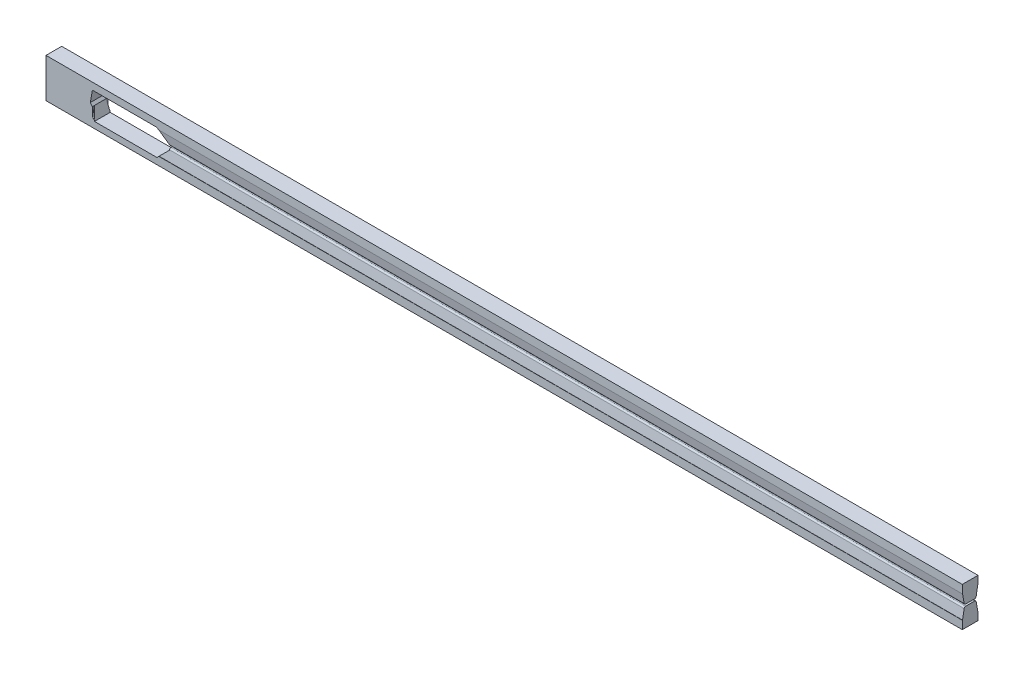
from build123d import *

# Parameters (mm, degrees)
EXTRUDE_THIN3_DEPTH      = 664
EXTRUDE_THIN3_DEPTH_BACK = 818
SKETCH1_W                = 25.4
SKETCH1_H                = 30.226
CUT_EXTRUDE1_DEPTH       = 674
CUT_EXTRUDE1_DEPTH_BACK  = 743
SKETCH4_W                = 80
SKETCH4_H                = 25.4
BOSS_EXTRUDE1_DEPTH      = 3.048
CUT_EXTRUDE2_DEPTH       = 178


with BuildPart() as part:
    # Sketch1 → Extrude-Thin3 (new, two sides: drawn at the far end of the back side and taken through both)
    with BuildSketch(Plane(origin=(0, 0, 0), x_dir=(0, 0, -1), z_dir=(1, 0, 0)).offset(-EXTRUDE_THIN3_DEPTH_BACK)):
        with Locations((-93.98, -189.611)):
            Rectangle(SKETCH1_W, SKETCH1_H)
    extrude(amount=EXTRUDE_THIN3_DEPTH + EXTRUDE_THIN3_DEPTH_BACK)

    # Sketch3 → Cut-Extrude1 (cut, two sides: drawn at the far end of the back side and taken through both)
    with BuildSketch(Plane(origin=(0, 0, 0), x_dir=(0, 0, -1), z_dir=(1, 0, 0)).offset(-CUT_EXTRUDE1_DEPTH_BACK)):
        with BuildLine():
            Line((-81.650098629, -187.772933629), (-84.268930353, -202.625066371))
            ThreePointArc((-84.268930353, -202.625066371), (-85.137661517, -204.129752886), (-86.770342046, -204.724))
            Line((-86.770342046, -204.724), (-101.189657954, -204.724))
            ThreePointArc((-101.189657954, -204.724), (-102.822338483, -204.129752886), (-103.691069647, -202.625066371))
            Line((-103.691069647, -202.625066371), (-106.309901371, -187.772933629))
            Line((-106.309901371, -187.772933629), (-112.090636736, -187.772933629))
            Line((-112.090636736, -187.772933629), (-112.090636736, -212.168156894))
            Line((-112.090636736, -212.168156894), (-76.546243061, -212.168156894))
            Line((-76.546243061, -212.168156894), (-76.546243061, -187.772933629))
            Line((-76.546243061, -187.772933629), (-81.650098629, -187.772933629))
        make_face()
    extrude(amount=CUT_EXTRUDE1_DEPTH + CUT_EXTRUDE1_DEPTH_BACK, mode=Mode.SUBTRACT)


with BuildPart() as body_2:
    # Mirror3: mirrored copy
    add(part.part.mirror(Plane.ZX.offset(-206.248)))


with BuildPart() as part_1:
    add(part.part)

    add(body_2.part)  # Boss-Extrude1 merges body 2
    # Sketch4 → Boss-Extrude1 (add)
    with BuildSketch(Plane(origin=(0, -207.772, 0), x_dir=(1, 0, 0), z_dir=(0, 1, 0))):
        with Locations((-778, -93.98)):
            Rectangle(SKETCH4_W, SKETCH4_H)
    extrude(amount=BOSS_EXTRUDE1_DEPTH)

    # Sketch6 → Cut-Extrude2 (cut)
    with BuildSketch(Plane.XY):
        Polygon((-638.463603746, -185.674), (-742.95, -185.674), (-744.293611593, -193.294), (-746.309028982, -204.724), (-742.95, -208.788), (-740.934582611, -220.218), (-739.590971018, -227.838), (-638.640030294, -227.838), (-621.247897552, -210.445867257), (-621.247897552, -202.889706194), align=None)
    extrude(amount=CUT_EXTRUDE2_DEPTH, mode=Mode.SUBTRACT)


solid = part_1.part
